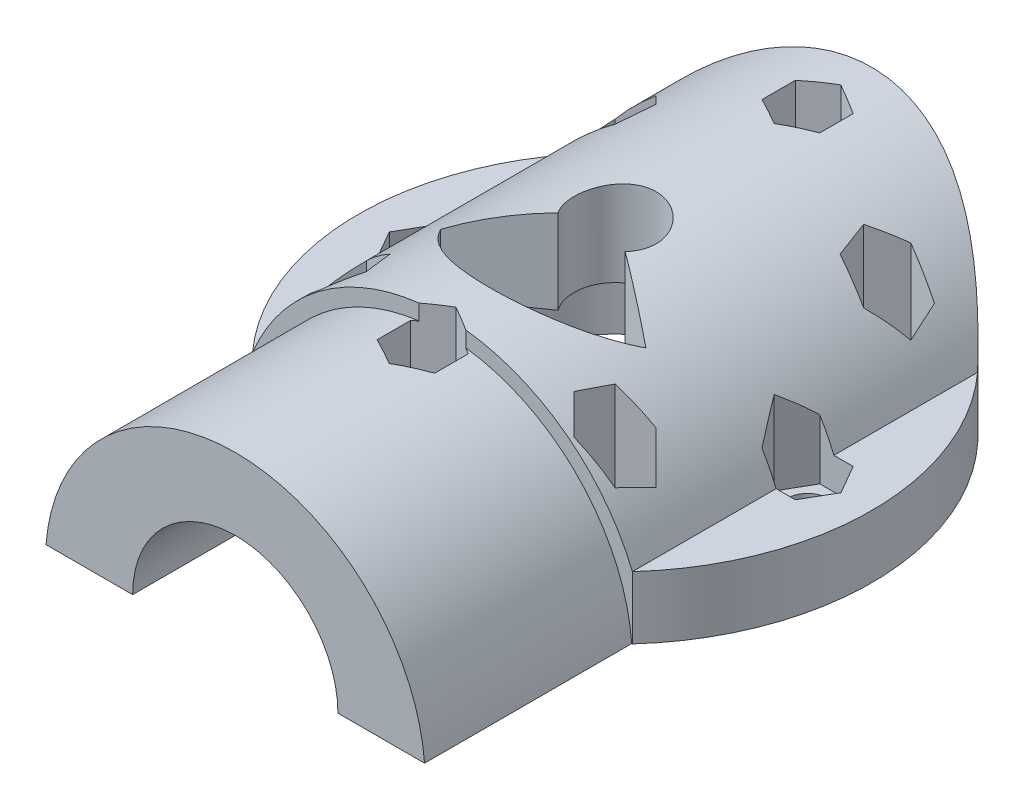
from build123d import *

# Parameters (mm, degrees)
SKETCH_1_R               = 25
SKETCH_1_R_2             = 12
EXTRUDE_1_DEPTH          = 10
SKETCH_2_R               = 25
SKETCH_2_R_2             = 4
EXTRUDE_2_DEPTH          = 10
SKETCH_5_W               = 37
SKETCH_5_H               = 20
EXTRUDE_3_DEPTH          = 25
CUT_EXTRUDE_1_DEPTH      = 20.184828
SKETCH_8_R               = 2
CUT_EXTRUDE_2_DEPTH      = 49.928519291
CUT_EXTRUDE_4_DEPTH      = 10
CUT_EXTRUDE_5_DEPTH      = 70.778220126
CUT_EXTRUDE_6_DEPTH      = 15.5
SKETCH_12_R              = 10
CUT_EXTRUDE_7_DEPTH      = 30
CUT_EXTRUDE_8_DEPTH      = 46.760244912
CUT_EXTRUDE_8_DEPTH_BACK = 46.760244912


with BuildPart() as part:
    # 草图1 → 凸台-拉伸1 (new body)
    with BuildSketch(Plane(origin=(0, 0, 0), x_dir=(1, 0, 0), z_dir=(0, 1, 0))):
        with Locations(Location((0, 0, 0), (0, 0, 270))):
            Circle(SKETCH_1_R)
        with Locations(Location((0, 0, 0), (0, 0, 270))):
            Circle(SKETCH_1_R_2, mode=Mode.SUBTRACT)
    extrude(amount=EXTRUDE_1_DEPTH)

    # 草图2 → 凸台-拉伸2 (add)
    with BuildSketch(Plane(origin=(0, 10, 0), x_dir=(1, 0, 0), z_dir=(0, 1, 0))):
        with Locations(Location((0, 0, 0), (0, 0, 270))):
            Circle(SKETCH_2_R)
        with Locations(Location((0, 0, 0), (0, 0, 270))):
            Circle(SKETCH_2_R_2, mode=Mode.SUBTRACT)
    extrude(amount=EXTRUDE_2_DEPTH)

    # 草图5 → 凸台-拉伸3 (add)
    with BuildSketch(Plane.XY.offset(12)):
        with Locations((0, 10)):
            Rectangle(SKETCH_5_W, SKETCH_5_H)
    extrude(amount=EXTRUDE_3_DEPTH)

    # 草图6 → 切除-拉伸1 (cut)
    with BuildSketch(Plane.XY.offset(37)):
        with BuildLine():
            Line((-18.490572983, -0.909482628), (-28.986413715, -0.909482628))
            Line((-28.986413715, -0.909482628), (-28.986413715, 31.85575571))
            Line((-28.986413715, 31.85575571), (34.685567791, 31.85575571))
            Line((34.685567791, 31.85575571), (34.685567791, -1.610938363))
            Line((34.685567791, -1.610938363), (18.499667367, -1.610938363))
            ThreePointArc((18.499667367, -1.610938363), (0.350757344, 16.996674547), (-18.490572983, -0.909482628))
        make_face()
    extrude(amount=-CUT_EXTRUDE_1_DEPTH, mode=Mode.SUBTRACT)

    # 草图8 → 切除-拉伸2 (cut, through all)
    with BuildSketch(Plane.XZ):
        with Locations(Location((18.75, 0, 0), (0, 0, 270))):
            Circle(SKETCH_8_R)
        with Locations(Location((13.258252147, 13.258252147, 0), (0, 0, 270))):
            Circle(SKETCH_8_R)
        with Locations(Location((0, 18.75, 0), (0, 0, 284.666911028))):
            Circle(SKETCH_8_R)
        with Locations(Location((-18.75, 0, 0), (0, 0, 90))):
            Circle(SKETCH_8_R)
        with Locations(Location((-13.258252147, 13.258252147, 0), (0, 0, 90))):
            Circle(SKETCH_8_R)
        with Locations(Location((13.258252147, -13.258252147, 0), (0, 0, 90))):
            Circle(SKETCH_8_R)
        with Locations(Location((0, -18.75, 0), (0, 0, 270))):
            Circle(SKETCH_8_R)
        with Locations(Location((-13.258252147, -13.258252147, 0), (0, 0, 270))):
            Circle(SKETCH_8_R)
    extrude(amount=-CUT_EXTRUDE_2_DEPTH, mode=Mode.SUBTRACT)

    # 草图9 → 切除-拉伸4 (cut)
    with BuildSketch(Plane(origin=(0, 0, 0), x_dir=(1, 0, 0), z_dir=(0, 1, 0))):
        Polygon((0, 0), (10.593685304, 25.575418736), (-10.593685304, 25.575418736), align=None)
    extrude(amount=CUT_EXTRUDE_4_DEPTH, mode=Mode.SUBTRACT)

    # 草图10 → 切除-拉伸5 (cut, through all)
    with BuildSketch(Plane.XY.offset(37)):
        with BuildLine():
            Line((-18.5, 6.099342077), (-25, 6.099342077))
            Line((-25, 6.099342077), (-25, 20))
            Line((-25, 20), (25, 20))
            Line((25, 20), (25, 6.099342077))
            Line((25, 6.099342077), (18.5, 6.099342077))
            ThreePointArc((18.5, 6.099342077), (0, 18.5), (-18.5, 6.099342077))
        make_face()
    extrude(amount=-CUT_EXTRUDE_5_DEPTH, mode=Mode.SUBTRACT)

    # 草图11 → 切除-拉伸6 (cut)
    with BuildSketch(Plane(origin=(0, 18.5, 0), x_dir=(1, 0, 0), z_dir=(0, 1, 0))):
        Polygon((0, -15.5), (-2.814582562, -17.125), (-2.814582562, -20.375), (0, -22), (2.814582562, -20.375), (2.814582562, -17.125), align=None)
        Polygon((-14.099414044, -10.118993212), (-10.960155108, -10.960155108), (-10.118993212, -14.099414044), (-12.417090251, -16.397511083), (-15.556349186, -15.556349186), (-16.397511083, -12.417090251), align=None)
        Polygon((10.960155108, -10.960155108), (10.118993212, -14.099414044), (12.417090251, -16.397511083), (15.556349186, -15.556349186), (16.397511083, -12.417090251), (14.099414044, -10.118993212), align=None)
        Polygon((-10.118993212, 14.099414044), (-10.960155108, 10.960155108), (-14.099414044, 10.118993212), (-16.397511083, 12.417090251), (-15.556349186, 15.556349186), (-12.417090251, 16.397511083), align=None)
        Polygon((-17.125, 2.814582562), (-15.5, 0), (-17.125, -2.814582562), (-20.375, -2.814582562), (-22, 0), (-20.375, 2.814582562), align=None)
        Polygon((10.960155108, 10.960155108), (14.099414044, 10.118993212), (16.397511083, 12.417090251), (15.556349186, 15.556349186), (12.417090251, 16.397511083), (10.118993212, 14.099414044), align=None)
        Polygon((15.5, 0), (17.125, -2.814582562), (20.375, -2.814582562), (22, 0), (20.375, 2.814582562), (17.125, 2.814582562), align=None)
        Polygon((2.814582562, 17.125), (0, 15.5), (-2.814582562, 17.125), (-2.814582562, 20.375), (0, 22), (2.814582562, 20.375), align=None)
    extrude(amount=-CUT_EXTRUDE_6_DEPTH, mode=Mode.SUBTRACT)

    # 草图12 → 切除-拉伸7 (cut)
    with BuildSketch(Plane.XY.offset(37)):
        Circle(SKETCH_12_R)
    extrude(amount=-CUT_EXTRUDE_7_DEPTH, mode=Mode.SUBTRACT)

    # 草图13 → 切除-拉伸8 (cut, two sides: drawn at the far end of the back side and taken through both)
    with BuildSketch(Plane.XZ.offset(-10).offset(-CUT_EXTRUDE_8_DEPTH_BACK)):
        with BuildLine():
            Line((0, 0), (-10, 7))
            ThreePointArc((-10, 7), (0, 12.206555616), (10, 7))
            Line((10, 7), (0, 0))
        make_face()
    extrude(amount=CUT_EXTRUDE_8_DEPTH + CUT_EXTRUDE_8_DEPTH_BACK, mode=Mode.SUBTRACT)


solid = part.part
